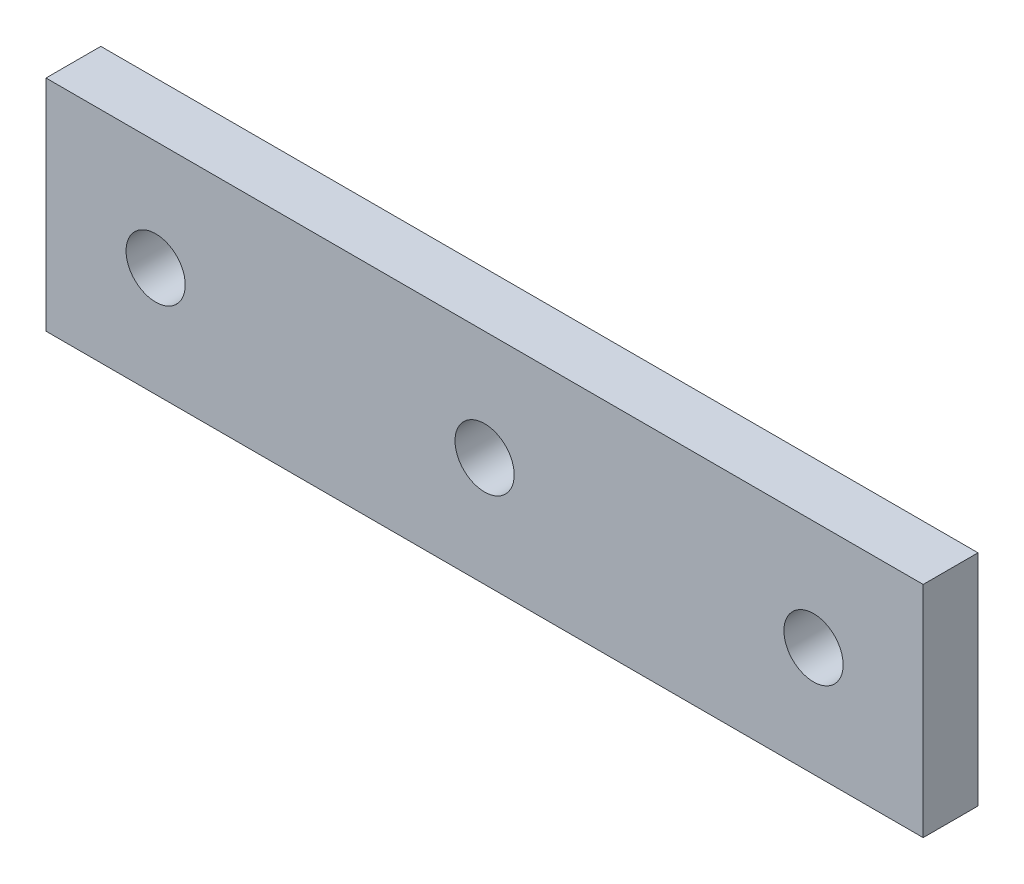
from build123d import *

# Parameters (mm, degrees)
SKETCH1_W           = 101.6
SKETCH1_H           = 25.4
SKETCH1_R           = 3.429
BOSS_EXTRUDE1_DEPTH = 6.35


with BuildPart() as part:
    # Sketch1 → Boss-Extrude1 (new body)
    with BuildSketch(Plane.XY):
        Rectangle(SKETCH1_W, SKETCH1_H)
        Circle(SKETCH1_R, mode=Mode.SUBTRACT)
        with Locations((-38.1, 0)):
            Circle(SKETCH1_R, mode=Mode.SUBTRACT)
        with Locations(Location((38.1, 0, 0), (0, 0, 180))):
            Circle(SKETCH1_R, mode=Mode.SUBTRACT)
    extrude(amount=BOSS_EXTRUDE1_DEPTH)


solid = part.part
